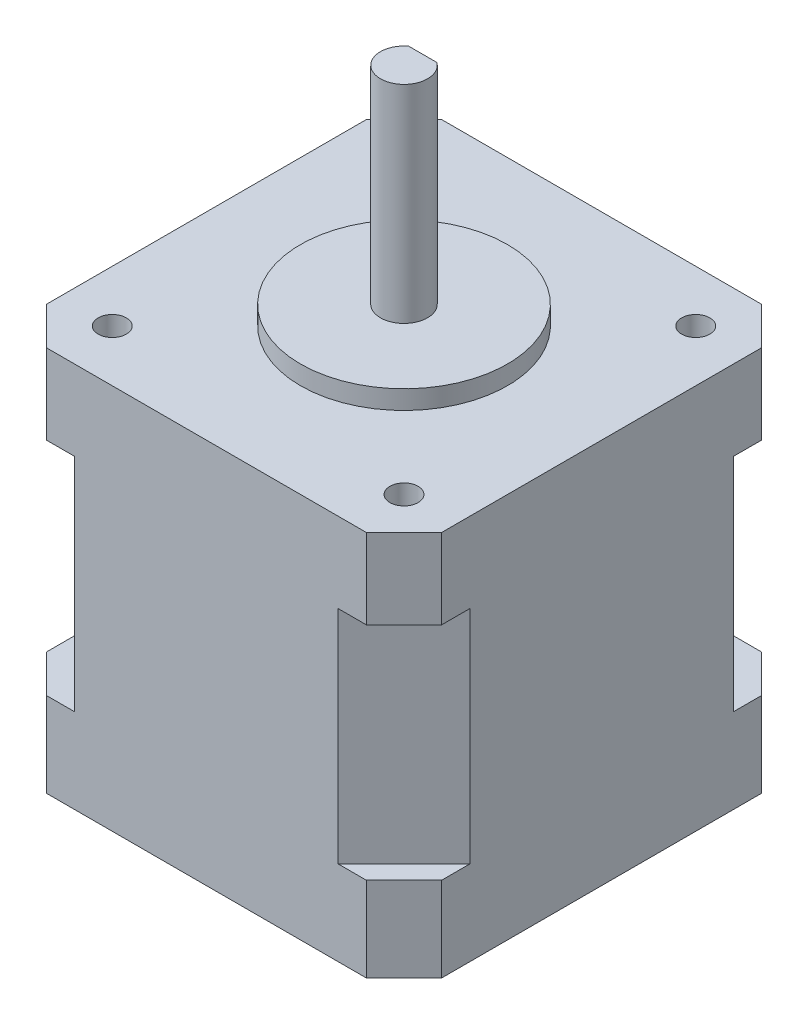
from build123d import *

# Parameters (mm, degrees)
ESQUISSE1_W                       = 42
ESQUISSE1_H                       = 42
BOSS_EXTRU_1_DEPTH                = 41
ESQUISSE2_R                       = 11
BOSS_EXTRU_2_DEPTH                = 2
BOSS_EXTRU_3_DEPTH                = 22
DIAM_TRE_DU_PER_AGE_3_0_3_1_D     = 3
DIAM_TRE_DU_PER_AGE_3_0_3_1_DEPTH = 4.8
DIAM_TRE_DU_PER_AGE_3_0_3_1_TIP   = 0.901290929
CHANFREIN1_SIZE                   = 4
ENL_V_START                       = 9
ENL_V_MAT_EXTRU_1_DEPTH           = 23.5
ESQUISSE5_R                       = 0.7
ESQUISSE5_R_2                     = 0.654723083
BOSS_EXTRU_4_DEPTH                = 10


with BuildPart() as part:
    # Esquisse1 → Boss.-Extru.1 (new body)
    with BuildSketch(Plane(origin=(0, 0, 0), x_dir=(1, 0, 0), z_dir=(0, 1, 0))):
        Rectangle(ESQUISSE1_W, ESQUISSE1_H)
    extrude(amount=BOSS_EXTRU_1_DEPTH)

    # Esquisse2 → Boss.-Extru.2 (add)
    with BuildSketch(Plane(origin=(0, 41, 0), x_dir=(1, 0, 0), z_dir=(0, 1, 0))):
        with Locations(Location((0, 0, 0), (0, 0, 270))):
            Circle(ESQUISSE2_R)
    extrude(amount=BOSS_EXTRU_2_DEPTH)

    # Esquisse3 → Boss.-Extru.3 (add)
    with BuildSketch(Plane(origin=(0, 43, 0), x_dir=(1, 0, 0), z_dir=(0, 1, 0))):
        with BuildLine():
            Line((-1.5, 2), (1.5, 2))
            ThreePointArc((1.5, 2), (0, -2.5), (-1.5, 2))
        make_face()
    extrude(amount=BOSS_EXTRU_3_DEPTH)

    # Diamètre du perçage Ø3.0 (3)1
    with Locations(Plane(origin=(0, 41, 0), x_dir=(1, 0, 0), z_dir=(0, 1, 0))):
        with Locations((-15.5, 15.5), (15.5, 15.5), (15.5, -15.5), (-15.5, -15.5)):
            Hole(DIAM_TRE_DU_PER_AGE_3_0_3_1_D / 2, depth=DIAM_TRE_DU_PER_AGE_3_0_3_1_DEPTH)
            with Locations((0, 0, -(DIAM_TRE_DU_PER_AGE_3_0_3_1_DEPTH + DIAM_TRE_DU_PER_AGE_3_0_3_1_TIP / 2))):  # 118° drill point
                Cone(0, DIAM_TRE_DU_PER_AGE_3_0_3_1_D / 2, DIAM_TRE_DU_PER_AGE_3_0_3_1_TIP, mode=Mode.SUBTRACT)

    # Chanfrein1
    chanfrein1_edges = [part.edges().sort_by_distance(p)[0] for p in [
        (-21, 20.5, -21),
        (21, 20.5, -21),
        (21, 20.5, 21),
        (-21, 20.5, 21),
    ]]
    chamfer(chanfrein1_edges, length=CHANFREIN1_SIZE)

    # Esquisse4 → Enlèv. mat.-Extru.1 (cut)
    with BuildSketch(Plane(origin=(0, 0, 0), x_dir=(1, 0, 0), z_dir=(0, 1, 0)).offset(ENL_V_START)):
        Polygon((-14, 21), (-21, 14), (-21, 21), align=None)
        Polygon((21, 21), (14, 21), (21, 14), align=None)
        Polygon((14, -21), (21, -14), (21, -21), align=None)
        Polygon((-21, -21), (-14, -21), (-21, -14), align=None)
    extrude(amount=ENL_V_MAT_EXTRU_1_DEPTH, mode=Mode.SUBTRACT)

    # Esquisse5 → Boss.-Extru.4 (add)
    with BuildSketch(Plane.ZY.offset(21)):
        with Locations(Location((-1, 7, 0), (0, 0, 180))):
            Circle(ESQUISSE5_R)
        with Locations(Location((-1, 5, 0), (0, 0, 180))):
            Circle(ESQUISSE5_R_2)
        with Locations(Location((1, 5, 0), (0, 0, 180))):
            Circle(ESQUISSE5_R_2)
        with Locations(Location((1, 7, 0), (0, 0, 180))):
            Circle(ESQUISSE5_R)
    extrude(amount=BOSS_EXTRU_4_DEPTH)


solid = part.part
